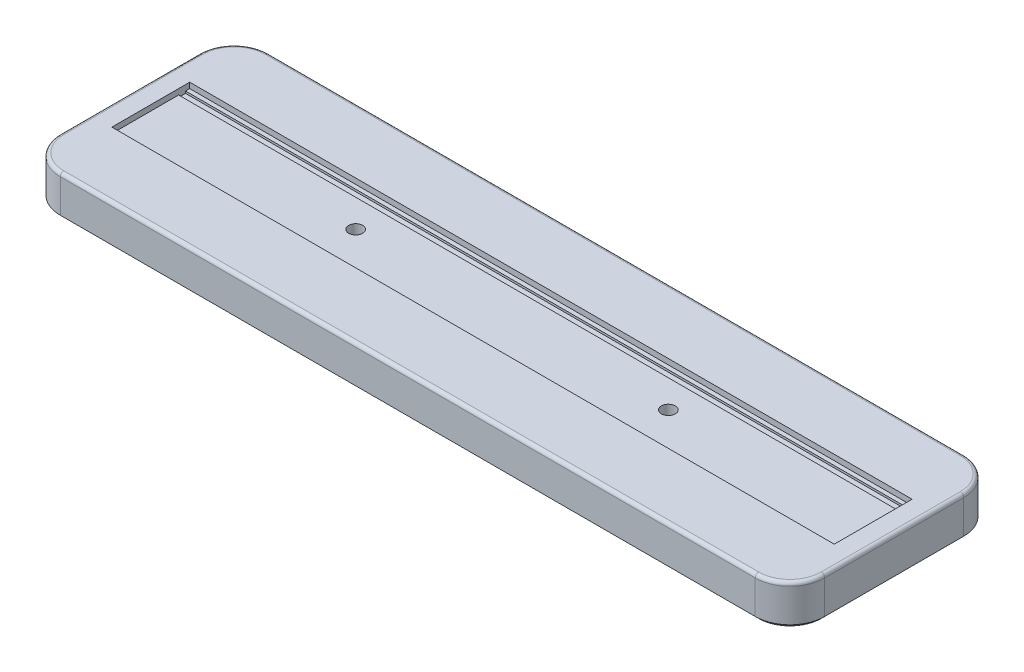
from build123d import *

# Parameters (mm, degrees)
SKETCH1_W           = 207.9
SKETCH1_H           = 22.4
SKETCH1_R           = 2
BOSS_EXTRUDE1_DEPTH = 10
SKETCH2_W           = 220
SKETCH2_H           = 60
SKETCH2_W_2         = 207.9
SKETCH2_H_2         = 22.4
BOSS_EXTRUDE2_DEPTH = 11.6
FILLET1_R           = 10
FILLET2_R           = 1
CHAMFER1_SIZE       = 1
SKETCH3_W           = 207.9
SKETCH3_H           = 2
CUT_EXTRUDE1_DEPTH  = 0.6


with BuildPart() as part:
    # Sketch1 → Boss-Extrude1 (new body)
    with BuildSketch(Plane(origin=(0, 0, 0), x_dir=(1, 0, 0), z_dir=(0, 1, 0))):
        Rectangle(SKETCH1_W, SKETCH1_H)
        with Locations(Location((-45, 0, 0), (0, 0, 270))):
            Circle(SKETCH1_R, mode=Mode.SUBTRACT)
        with Locations(Location((45, 0, 0), (0, 0, 270))):
            Circle(SKETCH1_R, mode=Mode.SUBTRACT)
    extrude(amount=BOSS_EXTRUDE1_DEPTH)

    # Sketch2 → Boss-Extrude2 (add)
    with BuildSketch(Plane.XZ):
        Rectangle(SKETCH2_W, SKETCH2_H)
        Rectangle(SKETCH2_W_2, SKETCH2_H_2, mode=Mode.SUBTRACT)
    extrude(amount=-BOSS_EXTRUDE2_DEPTH)

    # Fillet1
    fillet1_edges = [part.edges().sort_by_distance(p)[0] for p in [
        (-110, 5.8, 30),
        (-110, 5.8, -30),
        (110, 5.8, -30),
        (110, 5.8, 30),
    ]]
    fillet(fillet1_edges, radius=FILLET1_R)

    # Fillet2
    fillet2_edges = [part.edges().sort_by_distance(p)[0] for p in [
        (0, 11.6, 30),
        (-110, 11.6, 0),
        (110, 11.6, 0),
        (0, 11.6, -30),
        (107.071067812, 11.6, -27.071067812),
        (107.071067812, 11.6, 27.071067812),
        (-107.071067812, 11.6, -27.071067812),
        (-107.071067812, 11.6, 27.071067812),
    ]]
    fillet(fillet2_edges, radius=FILLET2_R)

    # Chamfer1
    chamfer1_edges = [part.edges().sort_by_distance(p)[0] for p in [
        (-45, 0, -2),
        (45, 0, -2),
        (0, 0, 30),
        (110, 0, 0),
        (-110, 0, 0),
        (0, 0, -30),
        (107.071067812, 0, -27.071067812),
        (107.071067812, 0, 27.071067812),
        (-107.071067812, 0, -27.071067812),
        (-107.071067812, 0, 27.071067812),
    ]]
    chamfer(chamfer1_edges, length=CHAMFER1_SIZE)

    # Sketch3 → Cut-Extrude1 (cut)
    with BuildSketch(Plane(origin=(0, 10, 0), x_dir=(1, 0, 0), z_dir=(0, 1, 0))):
        with Locations((0, 9)):
            Rectangle(SKETCH3_W, SKETCH3_H)
    extrude(amount=-CUT_EXTRUDE1_DEPTH, mode=Mode.SUBTRACT)


solid = part.part
